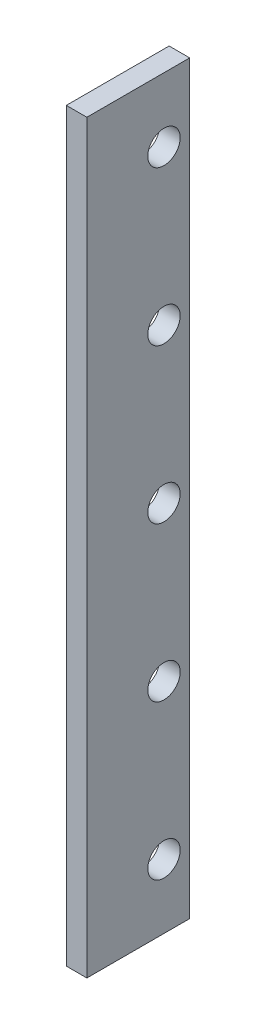
from build123d import *

# Parameters (mm, degrees)
SKETCH2_W           = 16
SKETCH2_H           = 80
BOSS_EXTRUDE1_DEPTH = 290
SKETCH3_R           = 12.6
CUT_EXTRUDE1_DEPTH  = 294.182536997
LPATTERN1_COUNT     = 5
LPATTERN1_PITCH     = 120


with BuildPart() as part:
    # Sketch2 → Boss-Extrude1 (new, symmetric)
    with BuildSketch(Plane(origin=(0, 0, 0), x_dir=(-1, 0, 0), z_dir=(0, 1, 0))):
        Rectangle(SKETCH2_W, SKETCH2_H)
    extrude(amount=BOSS_EXTRUDE1_DEPTH, both=True)

    # Sketch3 → Cut-Extrude1 (cut, through all)
    with BuildSketch(Plane.YZ.offset(8)):
        with Locations(Location((-240, -20, 0), (0, 0, 270))):
            Circle(SKETCH3_R)
    cut_extrude1 = extrude(amount=-CUT_EXTRUDE1_DEPTH, mode=Mode.SUBTRACT)

    # LPattern1: Cut-Extrude1 ×5
    with Locations(*[(0, i * LPATTERN1_PITCH, 0) for i in range(1, LPATTERN1_COUNT)]):
        add(cut_extrude1, mode=Mode.SUBTRACT)


solid = part.part
